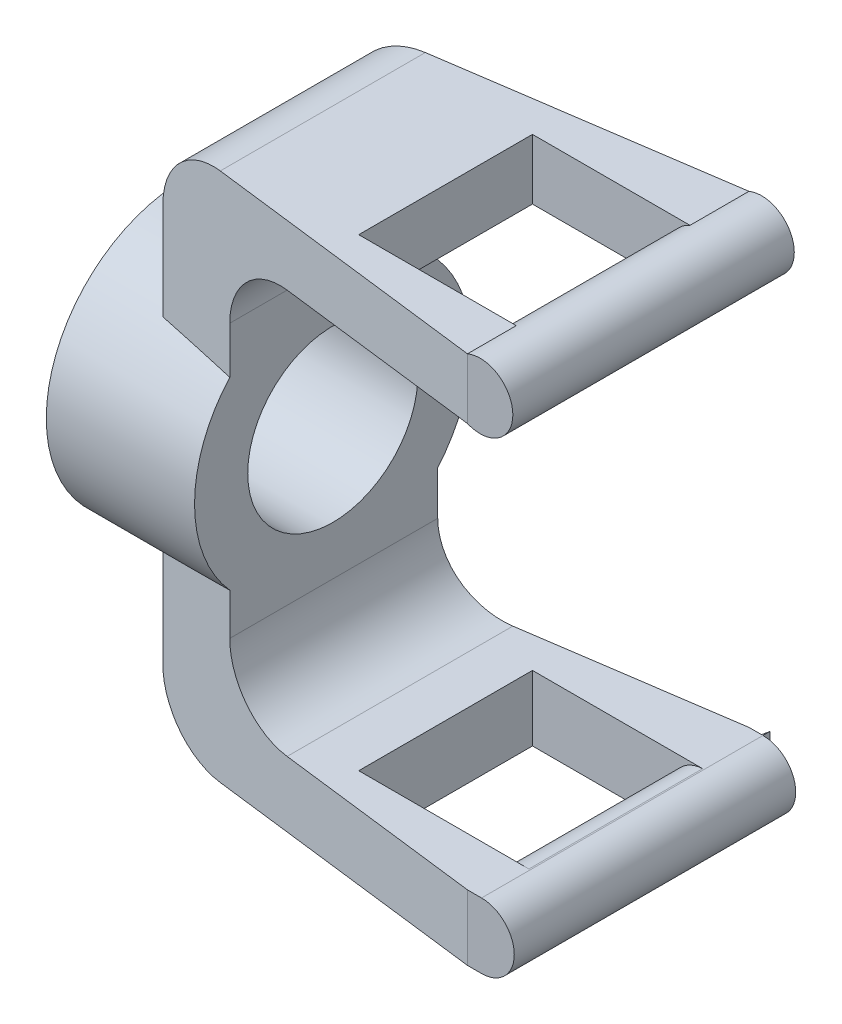
from build123d import *

# Parameters (mm, degrees)
BOSS_EXTRUDE1_DEPTH      = 60
CUT_EXTRUDE1_DEPTH       = 26
BOSS_EXTRUDE2_DEPTH      = 34
BOSS_EXTRUDE2_DEPTH_BACK = 9
SKETCH4_R                = 5
CUT_EXTRUDE2_DEPTH       = 117
CUT_EXTRUDE3_DEPTH       = 31
BOSS_EXTRUDE3_START      = -11.652052
SKETCH7_R                = 21.124192
SKETCH7_R_2              = 13
BOSS_EXTRUDE3_DEPTH      = 22.652052
FILLET1_R                = 10


with BuildPart() as part:
    # Sketch2 → Boss-Extrude1 (new body)
    with BuildSketch(Plane.XY):
        Polygon((-14.104352, 47.779255), (-57.46381, 47.779255), (-57.46381, -13.919632), (-13.887058, -13.919632), (-13.887058, -23.919632), (-69.115862, -23.919632), (-69.115862, 57.003505), (-14.104352, 57.003505), align=None)
    extrude(amount=BOSS_EXTRUDE1_DEPTH)

    # Sketch3 → Cut-Extrude1 (cut)
    with BuildSketch(Plane(origin=(-14.104352, 0, 0), x_dir=(0, 0, -1), z_dir=(1, 0, 0))):
        Polygon((-43.271654, -23.143882), (-43.271654, 57.003505), (-16.728346, 57.003505), (-16.728346, -23.143882), (-16.728346, -35.223541), (-43.271654, -35.223541), align=None)
    extrude(amount=-CUT_EXTRUDE1_DEPTH, mode=Mode.SUBTRACT)

    # Sketch4 → Boss-Extrude2 (add, two sides: drawn at the far end of the back side and taken through both)
    with BuildSketch(Plane.XY.offset(16.728346).offset(-BOSS_EXTRUDE2_DEPTH_BACK)):
        with Locations(Location((-14.104352, 52.39138, 0), (0, 0, 247.283219))):
            Circle(SKETCH4_R)
        with Locations((-13.887058, -18.919632)):
            Circle(SKETCH4_R)
    extrude(amount=BOSS_EXTRUDE2_DEPTH + BOSS_EXTRUDE2_DEPTH_BACK)

    # Sketch5 → Cut-Extrude2 (cut)
    with BuildSketch(Plane(origin=(0, 57.003505, 0), x_dir=(1, 0, 0), z_dir=(0, 1, 0))):
        Polygon((-14.104352, -7.728346), (-16.035233, -7.728346), (-69.115862, -15.56073), (-69.115862, 0), (-12.569793, 0), align=None)
        Polygon((-69.115862, -44.179694), (-16.035233, -50.728346), (-13.887058, -50.728346), (-13.887058, -60), (-69.115862, -60), align=None)
    extrude(amount=-CUT_EXTRUDE2_DEPTH, mode=Mode.SUBTRACT)

    # Sketch6 → Cut-Extrude3 (cut)
    with BuildSketch(Plane.ZY.offset(69.115862)):
        with BuildLine():
            ThreePointArc((42.870212, 16.541936), (29.870212, 29.541936), (16.870212, 16.541936))
            Line((16.870212, 16.541936), (42.870212, 16.541936))
        make_face()
        with BuildLine():
            Line((42.870212, 16.541936), (16.870212, 16.541936))
            ThreePointArc((16.870212, 16.541936), (29.870212, 3.541936), (42.870212, 16.541936))
        make_face()
    extrude(amount=-CUT_EXTRUDE3_DEPTH, mode=Mode.SUBTRACT)

    # Sketch7 → Boss-Extrude3 (add)
    with BuildSketch(Plane.ZY.offset(69.115862).offset(BOSS_EXTRUDE3_START)):
        with Locations((29.870212, 16.541936)):
            Circle(SKETCH7_R)
        with Locations((29.870212, 16.541936)):
            Circle(SKETCH7_R_2, mode=Mode.SUBTRACT)
    extrude(amount=BOSS_EXTRUDE3_DEPTH)

    # Fillet1
    fillet1_edges = [part.edges().sort_by_distance(p)[0] for p in [
        (-57.46381, -13.919632, 29.729312),
        (-57.46381, 47.779255, 29.729312),
        (-69.115862, 57.003505, 29.870212),
        (-69.115862, -23.919632, 29.870212),
    ]]
    fillet(fillet1_edges, radius=FILLET1_R)


solid = part.part
